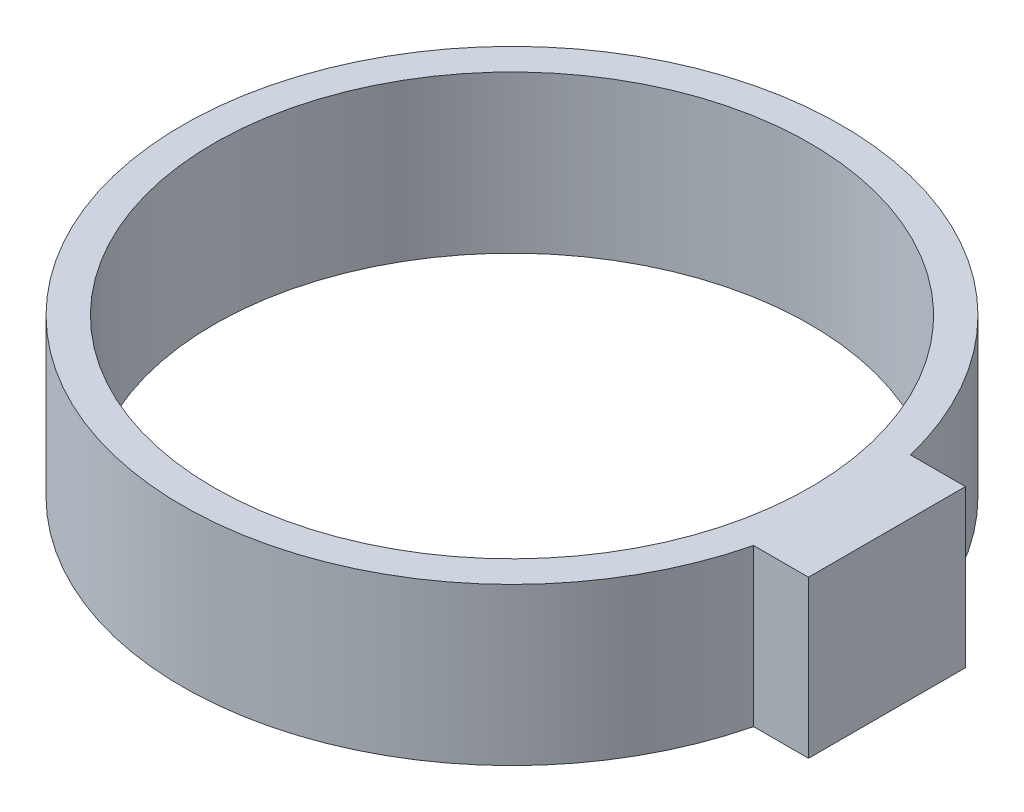
from build123d import *

# Parameters (mm, degrees)
SKETCH1_R           = 19
BOSS_EXTRUDE1_DEPTH = 10


with BuildPart() as part:
    # Sketch1 → Boss-Extrude1 (new body)
    with BuildSketch(Plane(origin=(0, 0, 0), x_dir=(1, 0, 0), z_dir=(0, 1, 0))):
        with BuildLine():
            Line((20.396078054, 5), (23.896078054, 5))
            Line((23.896078054, 5), (23.896078054, -5))
            Line((23.896078054, -5), (20.396078054, -5))
            ThreePointArc((20.396078054, -5), (-21, 0), (20.396078054, 5))
        make_face()
        with Locations(Location((0, 0, 0), (0, 0, 270))):
            Circle(SKETCH1_R, mode=Mode.SUBTRACT)
    extrude(amount=BOSS_EXTRUDE1_DEPTH)


solid = part.part
